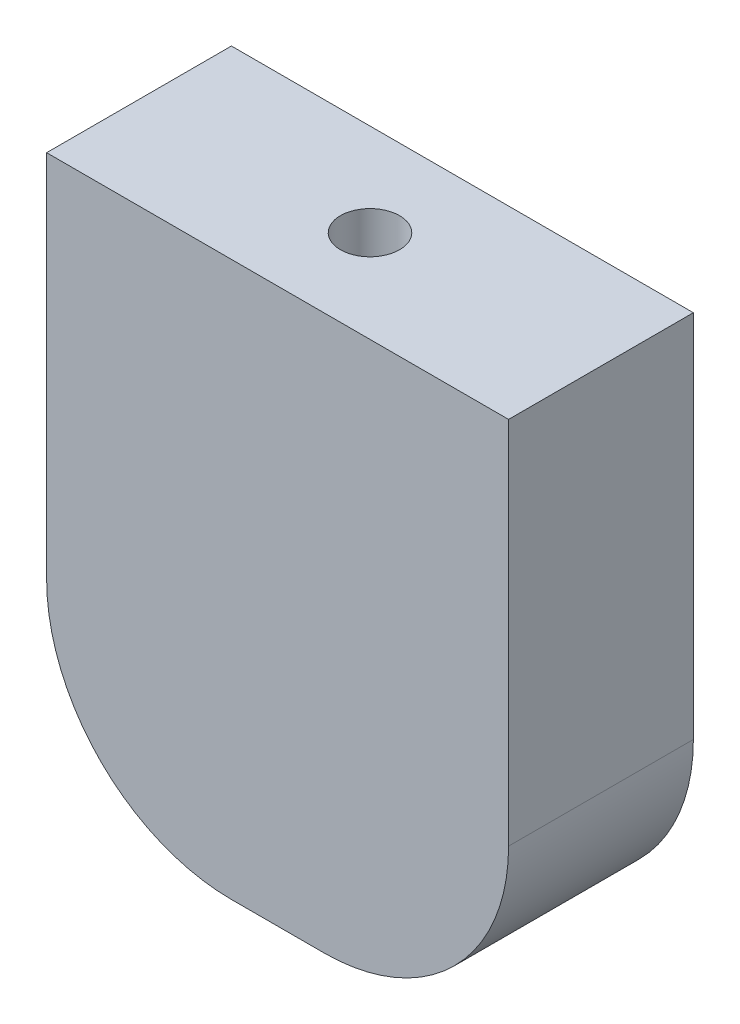
from build123d import *

# Parameters (mm, degrees)
SKETCH1_W          = 31.75
SKETCH1_H          = 38.1
EXTRUDE1_DEPTH     = 6.35
FILLET1_R          = 12.7
SKETCH2_R          = 2.032
CUT_EXTRUDE1_DEPTH = 12.7


with BuildPart() as part:
    # Sketch1 → Extrude1 (new, symmetric)
    with BuildSketch(Plane.XY):
        with Locations((22.225, 54.61)):
            Rectangle(SKETCH1_W, SKETCH1_H)
    extrude(amount=EXTRUDE1_DEPTH, both=True)

    # Fillet1
    fillet1_edges = [part.edges().sort_by_distance(p)[0] for p in [
        (38.1, 35.56, 0),
        (6.35, 35.56, 0),
    ]]
    fillet(fillet1_edges, radius=FILLET1_R)

    # Sketch2 → Cut-Extrude1 (cut)
    with BuildSketch(Plane(origin=(0, 73.66, 0), x_dir=(-1, 0, 0), z_dir=(0, 1, 0))):
        with Locations(Location((-22.225, 0, 0), (0, 0, 90))):
            Circle(SKETCH2_R)
    extrude(amount=-CUT_EXTRUDE1_DEPTH, mode=Mode.SUBTRACT)


solid = part.part
